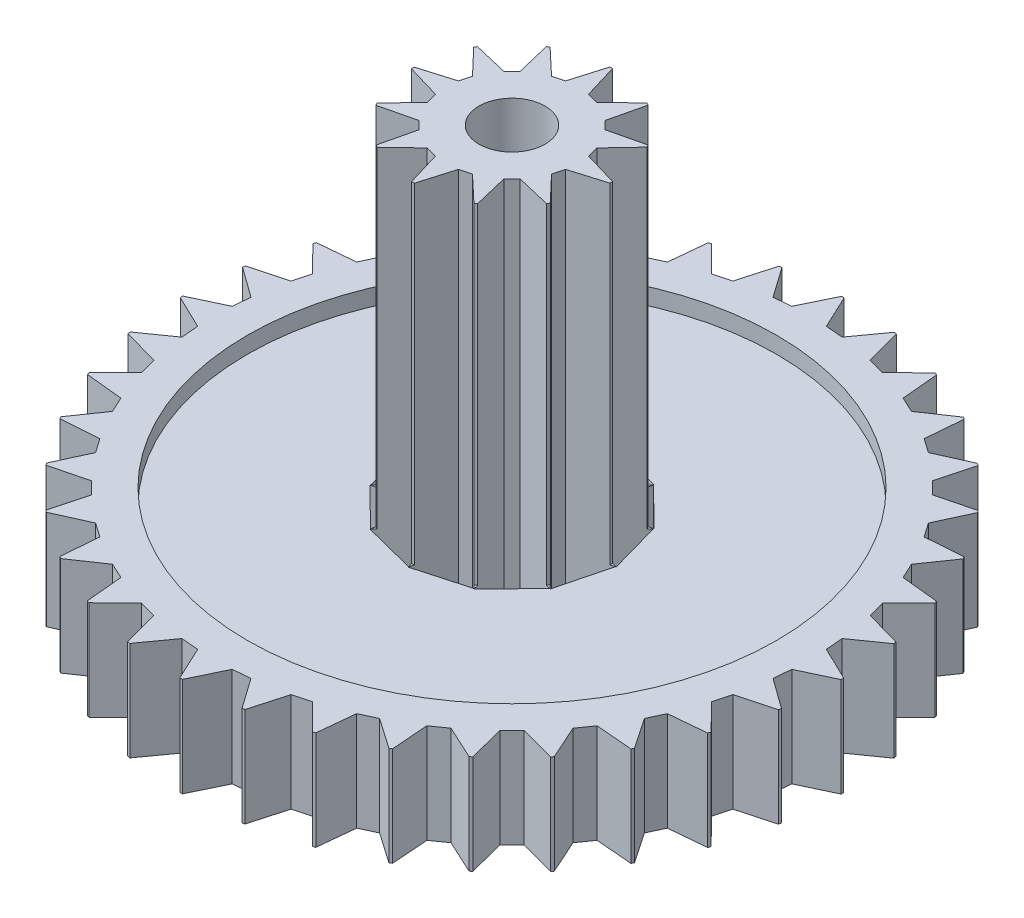
from build123d import *

# Parameters (mm, degrees)
SKETCH2_R           = 5
BOSS_EXTRUDE1_DEPTH = 1.5
CUT_EXTRUDE1_DEPTH  = 8.228416147
CIRPATTERN1_COUNT   = 36
SKETCH6_R           = 4
CUT_EXTRUDE2_DEPTH  = 0.25
SKETCH7_R           = 0.5
CUT_EXTRUDE3_DEPTH  = 8.228416147
CUT_EXTRUDE4_START  = -0.25
SKETCH8_R           = 4
SKETCH8_R_2         = 1
CUT_EXTRUDE4_DEPTH  = 0.25
SKETCH9_R           = 1.5
BOSS_EXTRUDE2_DEPTH = 5
SKETCH10_R          = 0.5
CUT_EXTRUDE5_DEPTH  = 10.437293044
CUT_EXTRUDE6_DEPTH  = 6.25
CIRPATTERN2_COUNT   = 12


with BuildPart() as part:
    # Sketch2 → Boss-Extrude1 (new body)
    with BuildSketch(Plane(origin=(0, 0, 0), x_dir=(1, 0, 0), z_dir=(0, 1, 0))):
        with Locations(Location((0, 0, 0), (0, 0, 270))):
            Circle(SKETCH2_R)
    extrude(amount=BOSS_EXTRUDE1_DEPTH)

    # Sketch4 → Cut-Extrude1 (cut, through all)
    with BuildSketch(Plane(origin=(0, 1.5, 0), x_dir=(1, 0, 0), z_dir=(0, 1, 0))):
        Polygon((0.26165173, 4.492386712), (0, 5.048851691), (0.874121418, 4.957388906), (0.522418114, 4.46957261), align=None)
    cut_extrude1 = extrude(amount=-CUT_EXTRUDE1_DEPTH, mode=Mode.SUBTRACT)

    # CirPattern1: Cut-Extrude1 ×36 about axis
    cirpattern1_axis = Axis((0, 0, 0), (0, 1, 0))
    for i in range(1, CIRPATTERN1_COUNT):
        add(cut_extrude1.rotate(cirpattern1_axis, i * 360 / CIRPATTERN1_COUNT), mode=Mode.SUBTRACT)

    # Sketch6 → Cut-Extrude2 (cut)
    with BuildSketch(Plane(origin=(0, 1.5, 0), x_dir=(1, 0, 0), z_dir=(0, 1, 0))):
        with Locations(Location((0, 0, 0), (0, 0, 270))):
            Circle(SKETCH6_R)
    extrude(amount=-CUT_EXTRUDE2_DEPTH, mode=Mode.SUBTRACT)

    # Sketch7 → Cut-Extrude3 (cut, through all)
    with BuildSketch(Plane(origin=(0, 1.5, 0), x_dir=(1, 0, 0), z_dir=(0, 1, 0))):
        with Locations(Location((0, 0, 0), (0, 0, 270))):
            Circle(SKETCH7_R)
    extrude(amount=-CUT_EXTRUDE3_DEPTH, mode=Mode.SUBTRACT)

    # Sketch8 → Cut-Extrude4 (cut)
    with BuildSketch(Plane(origin=(0, 0, 0), x_dir=(-1, 0, 0), z_dir=(0, -1, 0)).offset(CUT_EXTRUDE4_START)):
        with Locations(Location((0, 0, 0), (0, 0, 270))):
            Circle(SKETCH8_R)
        with Locations(Location((0, 0, 0), (0, 0, 90))):
            Circle(SKETCH8_R_2, mode=Mode.SUBTRACT)
    extrude(amount=CUT_EXTRUDE4_DEPTH, mode=Mode.SUBTRACT)

    # Sketch9 → Boss-Extrude2 (add)
    with BuildSketch(Plane(origin=(0, 1.25, 0), x_dir=(1, 0, 0), z_dir=(0, 1, 0))):
        with Locations(Location((0, 0, 0), (0, 0, 270))):
            Circle(SKETCH9_R)
    extrude(amount=BOSS_EXTRUDE2_DEPTH)

    # Sketch10 → Cut-Extrude5 (cut, through all)
    with BuildSketch(Plane(origin=(0, 6.25, 0), x_dir=(1, 0, 0), z_dir=(0, 1, 0))):
        with Locations(Location((0, 0, 0), (0, 0, 270))):
            Circle(SKETCH10_R)
    extrude(amount=-CUT_EXTRUDE5_DEPTH, mode=Mode.SUBTRACT)

    # Sketch11 → Cut-Extrude6 (cut)
    with BuildSketch(Plane(origin=(0, 6.25, 0), x_dir=(1, 0, 0), z_dir=(0, 1, 0))):
        Polygon((-0.984807753, 0.173648178), (-1.565317225, 0), (-1.36360311, 0.787276623), (-0.939692621, 0.342020143), align=None)
    cut_extrude6 = extrude(amount=-CUT_EXTRUDE6_DEPTH, mode=Mode.SUBTRACT)

    # CirPattern2: Cut-Extrude6 ×12 about axis
    cirpattern2_axis = Axis((0, 0, 0), (0, 1, 0))
    for i in range(1, CIRPATTERN2_COUNT):
        add(cut_extrude6.rotate(cirpattern2_axis, i * 360 / CIRPATTERN2_COUNT), mode=Mode.SUBTRACT)


solid = part.part
